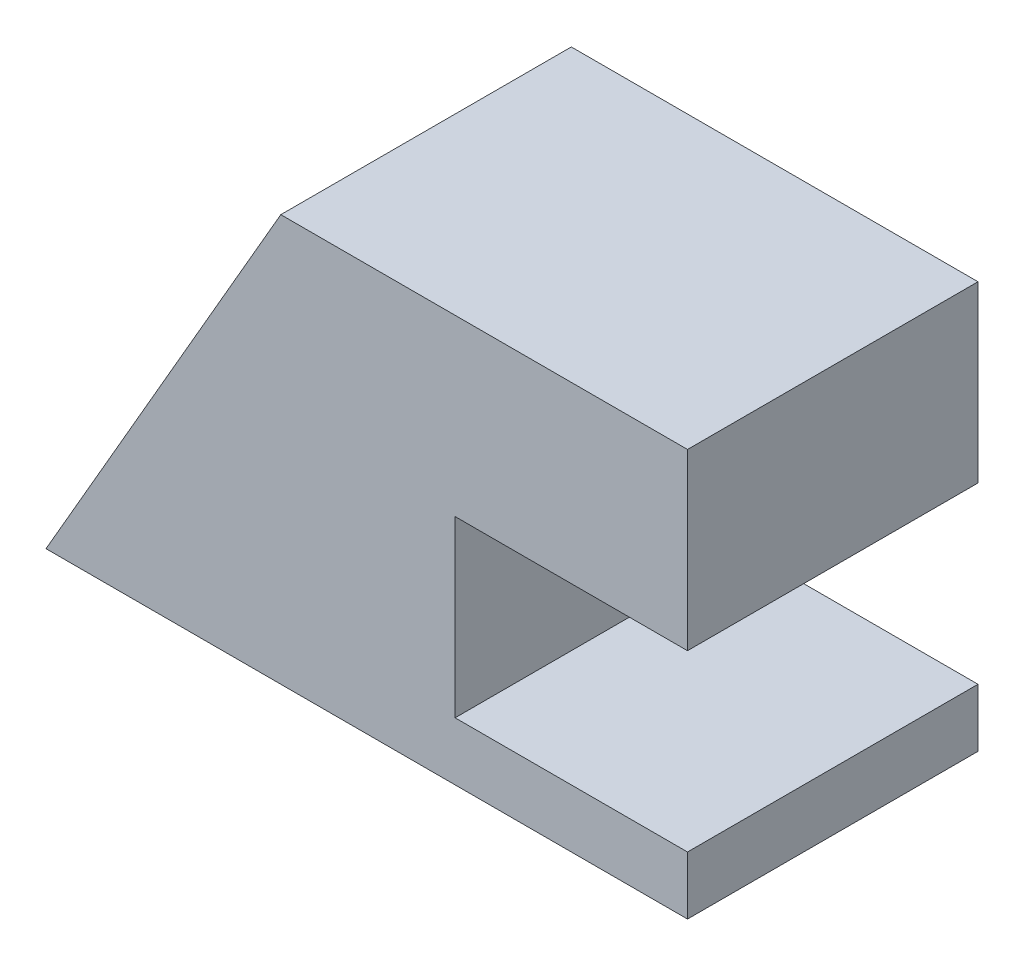
from build123d import *

# Parameters (mm, degrees)
BOSS_EXTRUDE1_DEPTH = 5


with BuildPart() as part:
    # Sketch1 → Boss-Extrude1 (new body)
    with BuildSketch(Plane.XY):
        Polygon((11.041451884, 7), (4.041451884, 7), (0, 0), (11.041451884, 0), (11.041451884, 1), (7.041451884, 1), (7.041451884, 4), (11.041451884, 4), align=None)
    extrude(amount=BOSS_EXTRUDE1_DEPTH)


solid = part.part
